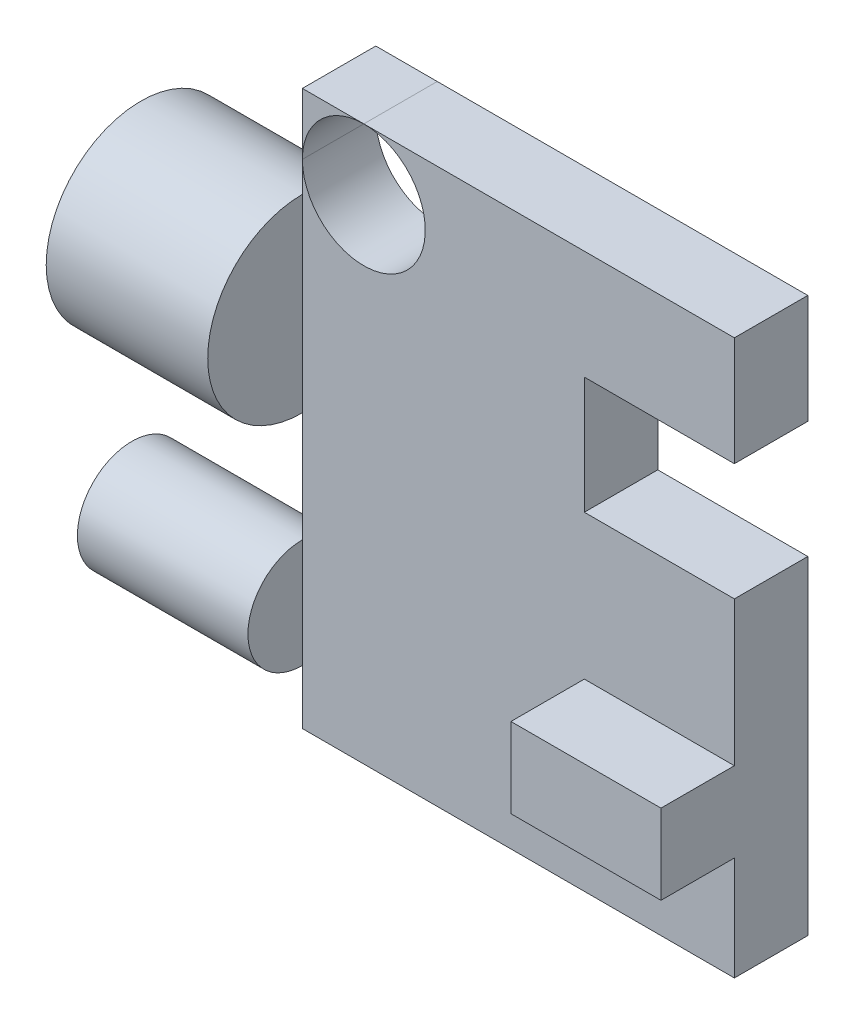
from build123d import *

# Parameters (mm, degrees)
SKETCH_1_W          = 58.847230119
SKETCH_1_H          = 75.520611986
EXTRUDE_1_DEPTH     = 10
SKETCH_2_W          = 22.002810591
SKETCH_2_H          = 12.891260339
SKETCH_3_W          = 23.231808856
SKETCH_3_H          = 7.415940087
SKETCH_4_W          = 20.437933357
SKETCH_4_H          = 15.940805794
CUT_EXTRUDE_1_DEPTH = 10
SKETCH_4_3_W        = 20.437933357
SKETCH_4_3_H        = 10.881332651
EXTRUDE_2_DEPTH     = 10
SKETCH_5_R          = 8.370863313
CUT_EXTRUDE_3_DEPTH = 10


with BuildPart() as part:
    # 草图1 → 凸台-拉伸1 (new body)
    with BuildSketch(Plane.XY):
        with Locations((29.42361506, 37.760305993)):
            Rectangle(SKETCH_1_W, SKETCH_1_H)
    extrude(amount=EXTRUDE_1_DEPTH)

    # 草图2 → 旋转1 (revolve)
    with BuildSketch(Plane.XY.offset(10)):
        with Locations((-11.001405296, 56.577387616)):
            Rectangle(SKETCH_2_W, SKETCH_2_H)
    revolve(axis=Axis((-22.002810591, 50.131757446, 10), (1, 0, 0)))

    # 草图3 → 旋转2 (revolve)
    with BuildSketch(Plane.XY.offset(10)):
        with Locations((-11.615904428, 18.562031188)):
            Rectangle(SKETCH_3_W, SKETCH_3_H)
    revolve(axis=Axis((-23.231808856, 14.854061144, 10), (1, 0, 0)))

    # 草图4 → 切除-拉伸1 (cut)
    with BuildSketch(Plane.XY.offset(10)):
        with Locations((48.628263441, 52.696147944)):
            Rectangle(SKETCH_4_W, SKETCH_4_H)
    extrude(amount=-CUT_EXTRUDE_1_DEPTH, mode=Mode.SUBTRACT)

    # 草图4<3> → 凸台-拉伸2 (add)
    with BuildSketch(Plane.XY.offset(10)):
        with Locations((48.628263441, 19.601648958)):
            Rectangle(SKETCH_4_3_W, SKETCH_4_3_H)
    extrude(amount=EXTRUDE_2_DEPTH)

    # 草图5 → 切除-拉伸3 (cut)
    with BuildSketch(Plane.XY.offset(10)):
        with Locations((8.370863313, 67.149748673)):
            Circle(SKETCH_5_R)
    extrude(amount=-CUT_EXTRUDE_3_DEPTH, mode=Mode.SUBTRACT)


with BuildPart() as cut_extrude_3_piece_1:
    # of the separate pieces the step leaves, piece 1, a body of its own (cut_extrude_3_pieces)
    add(part.part.solids().sort_by_distance((0, 0, 0))[0])


with BuildPart() as cut_extrude_3_piece_2:
    # of the separate pieces the step leaves, piece 2, a body of its own (cut_extrude_3_pieces)
    add(part.part.solids().sort_by_distance((0, 75.520611986, 0))[0])


solid = Compound([cut_extrude_3_piece_1.part, cut_extrude_3_piece_2.part])
